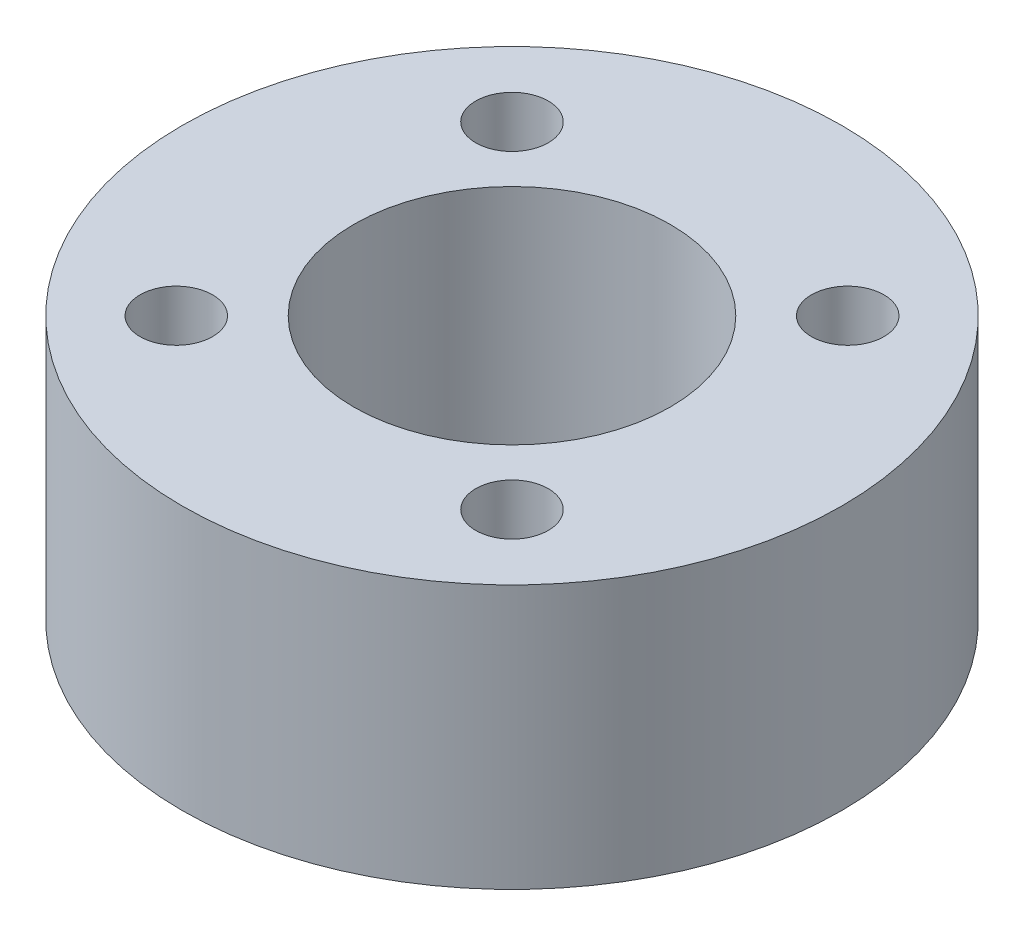
from build123d import *

# Parameters (mm, degrees)
SKETCH_1_R          = 25
EXTRUDE_1_DEPTH     = 20
SKETCH_2_R          = 12
CUT_EXTRUDE_1_DEPTH = 41.620192023
HOLE_WIZARD_M5_1_D  = 5.5


with BuildPart() as part:
    # ｽｹｯﾁ1 → ﾎﾞｽ - 押し出し1 (new body)
    with BuildSketch(Plane(origin=(0, 0, 0), x_dir=(1, 0, 0), z_dir=(0, 1, 0))):
        with Locations(Location((0, 0, 0), (0, 0, 270))):
            Circle(SKETCH_1_R)
    extrude(amount=EXTRUDE_1_DEPTH)

    # ｽｹｯﾁ2 → ｶｯﾄ - 押し出し1 (cut, through all)
    with BuildSketch(Plane(origin=(0, 20, 0), x_dir=(1, 0, 0), z_dir=(0, 1, 0))):
        with Locations(Location((0, 0, 0), (0, 0, 270))):
            Circle(SKETCH_2_R)
    extrude(amount=-CUT_EXTRUDE_1_DEPTH, mode=Mode.SUBTRACT)

    # M5 すきま穴1 (through all)
    with Locations(Plane.XZ):
        with Locations((-12.727922061, 12.727922061), (12.727922061, -12.727922061), (-12.727922061, -12.727922061), (12.727922061, 12.727922061)):
            Hole(HOLE_WIZARD_M5_1_D / 2)


solid = part.part
